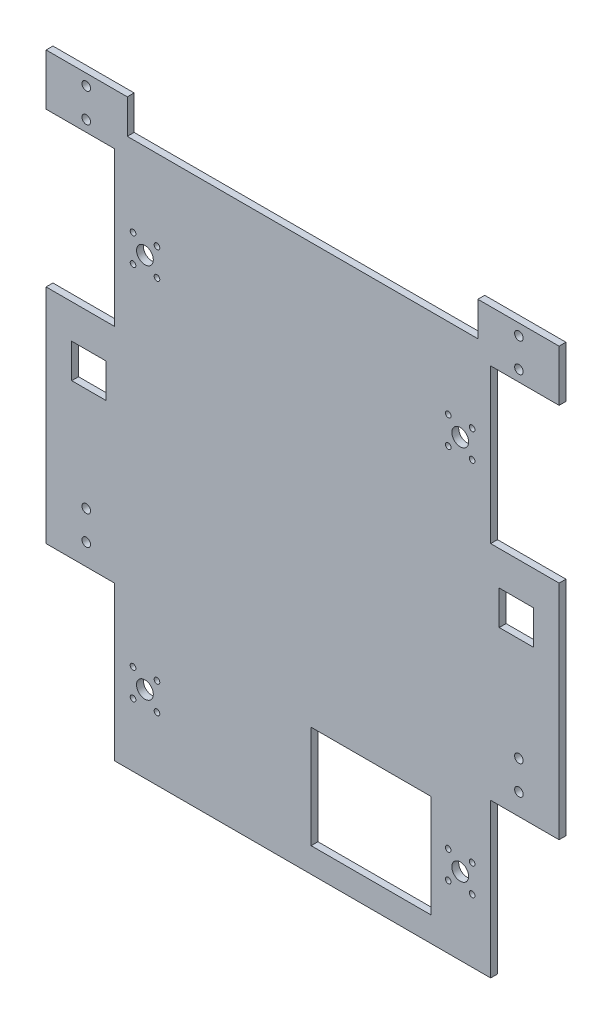
from build123d import *

# Parameters (mm, degrees)
SKETCH_2_R          = 1.65
SKETCH_2_R_2        = 4.9
SKETCH_2_R_3        = 2.5
EXTRUDE_1_DEPTH     = 4
SKETCH_5_W          = 20
SKETCH_5_H          = 20
CUT_EXTRUDE_1_DEPTH = 10
SKETCH_6_W          = 70
SKETCH_6_H          = 60
CUT_EXTRUDE_2_DEPTH = 10


with BuildPart() as part:
    # 草图2 → 凸台-拉伸1 (new body)
    with BuildSketch(Plane.XY):
        Polygon((40, 0), (260, 0), (260, 90), (300, 90), (300, 220), (260, 220), (260, 310), (300, 310), (300, 340), (252.5, 340), (252.5, 320), (47.5, 320), (47.5, 340), (0, 340), (0, 310), (40, 310), (40, 220), (0, 220), (0, 90), (40, 90), align=None)
        with Locations((50.85, 273)):
            Circle(SKETCH_2_R, mode=Mode.SUBTRACT)
        with Locations((64.85, 273)):
            Circle(SKETCH_2_R, mode=Mode.SUBTRACT)
        with Locations((64.85, 257)):
            Circle(SKETCH_2_R, mode=Mode.SUBTRACT)
        with Locations((50.85, 257)):
            Circle(SKETCH_2_R, mode=Mode.SUBTRACT)
        with Locations((57.8, 265)):
            Circle(SKETCH_2_R_2, mode=Mode.SUBTRACT)
        with Locations((235.15, 257)):
            Circle(SKETCH_2_R, mode=Mode.SUBTRACT)
        with Locations((249.15, 257)):
            Circle(SKETCH_2_R, mode=Mode.SUBTRACT)
        with Locations((242.2, 265)):
            Circle(SKETCH_2_R_2, mode=Mode.SUBTRACT)
        with Locations((235.15, 273)):
            Circle(SKETCH_2_R, mode=Mode.SUBTRACT)
        with Locations((249.15, 273)):
            Circle(SKETCH_2_R, mode=Mode.SUBTRACT)
        with Locations((249.15, 53)):
            Circle(SKETCH_2_R, mode=Mode.SUBTRACT)
        with Locations((235.15, 53)):
            Circle(SKETCH_2_R, mode=Mode.SUBTRACT)
        with Locations((249.15, 37)):
            Circle(SKETCH_2_R, mode=Mode.SUBTRACT)
        with Locations((242.2, 45)):
            Circle(SKETCH_2_R_2, mode=Mode.SUBTRACT)
        with Locations((235.15, 37)):
            Circle(SKETCH_2_R, mode=Mode.SUBTRACT)
        with Locations((50.85, 53)):
            Circle(SKETCH_2_R, mode=Mode.SUBTRACT)
        with Locations((64.85, 53)):
            Circle(SKETCH_2_R, mode=Mode.SUBTRACT)
        with Locations((64.85, 37)):
            Circle(SKETCH_2_R, mode=Mode.SUBTRACT)
        with Locations((57.8, 45)):
            Circle(SKETCH_2_R_2, mode=Mode.SUBTRACT)
        with Locations((50.85, 37)):
            Circle(SKETCH_2_R, mode=Mode.SUBTRACT)
        with Locations((23.5, 333.5)):
            Circle(SKETCH_2_R_3, mode=Mode.SUBTRACT)
        with Locations((23.5, 316.5)):
            Circle(SKETCH_2_R_3, mode=Mode.SUBTRACT)
        with Locations((276.5, 316.5)):
            Circle(SKETCH_2_R_3, mode=Mode.SUBTRACT)
        with Locations((276.5, 333.5)):
            Circle(SKETCH_2_R_3, mode=Mode.SUBTRACT)
        with Locations((23.5, 119.5)):
            Circle(SKETCH_2_R_3, mode=Mode.SUBTRACT)
        with Locations((23.5, 102.5)):
            Circle(SKETCH_2_R_3, mode=Mode.SUBTRACT)
        with Locations((276.5, 102.5)):
            Circle(SKETCH_2_R_3, mode=Mode.SUBTRACT)
        with Locations((276.5, 119.5)):
            Circle(SKETCH_2_R_3, mode=Mode.SUBTRACT)
    extrude(amount=EXTRUDE_1_DEPTH)

    # 草图5 → 切除-拉伸1 (cut)
    with BuildSketch(Plane.XY.offset(4)):
        with Locations((275, 190)):
            Rectangle(SKETCH_5_W, SKETCH_5_H)
        with Locations((25, 190)):
            Rectangle(SKETCH_5_W, SKETCH_5_H)
    extrude(amount=-CUT_EXTRUDE_1_DEPTH, mode=Mode.SUBTRACT)

    # 草图6 → 切除-拉伸2 (cut)
    with BuildSketch(Plane(origin=(0, 0, 0), x_dir=(-1, 0, 0), z_dir=(0, 0, -1))):
        with Locations((-190, 44.5)):
            Rectangle(SKETCH_6_W, SKETCH_6_H)
    extrude(amount=-CUT_EXTRUDE_2_DEPTH, mode=Mode.SUBTRACT)


solid = part.part
